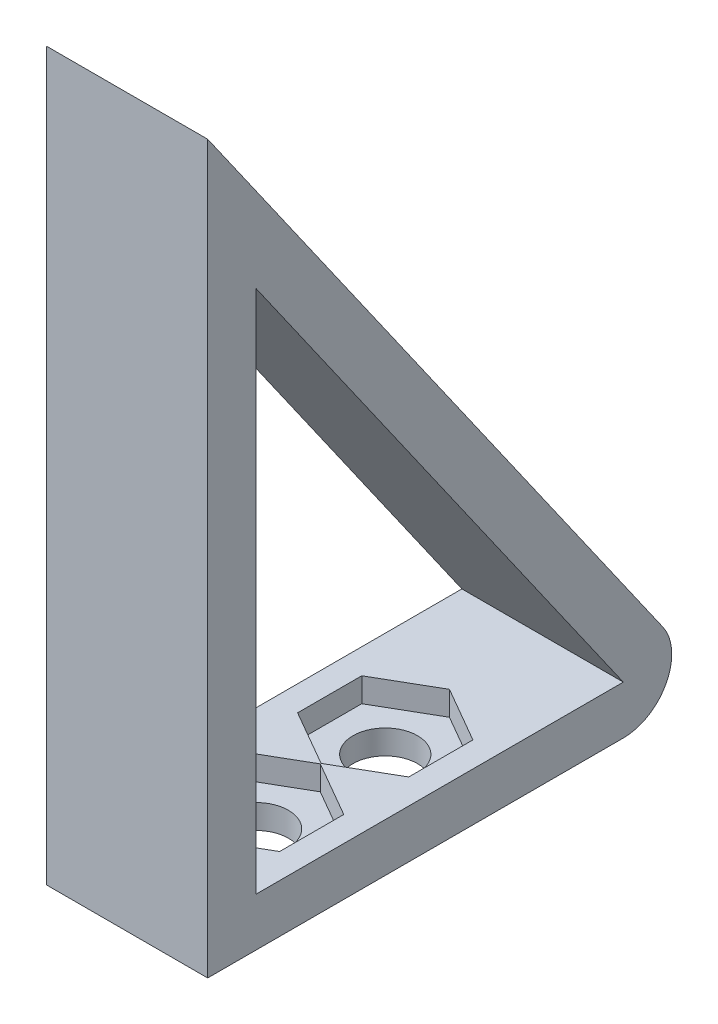
from build123d import *

# Parameters (mm, degrees)
BOSS_EXTRUDE1_DEPTH = 10
CUT_EXTRUDE1_DEPTH  = 56.837607918
SKETCH3_R           = 2
CUT_EXTRUDE2_DEPTH  = 3
CUT_EXTRUDE3_DEPTH  = 1.5
FILLET1_R           = 3


with BuildPart() as part:
    # Sketch1 → Boss-Extrude1 (new body)
    with BuildSketch(Plane(origin=(0, 0, 0), x_dir=(0, 0, -1), z_dir=(1, 0, 0))):
        Polygon((0, 0), (0, 45), (31.509339219, 0), align=None)
    extrude(amount=-BOSS_EXTRUDE1_DEPTH)

    # Sketch2 → Cut-Extrude1 (cut, through all)
    with BuildSketch(Plane(origin=(0, 0, 0), x_dir=(0, 0, -1), z_dir=(1, 0, 0))):
        Polygon((25.746392839, 3), (3, 35.485215593), (3, 3), align=None)
    extrude(amount=-CUT_EXTRUDE1_DEPTH, mode=Mode.SUBTRACT)

    # Sketch3 → Cut-Extrude2 (cut)
    with BuildSketch(Plane.XZ):
        with Locations(Location((-5, -8, 0), (0, 0, 270))):
            Circle(SKETCH3_R)
        with Locations(Location((-5, -16, 0), (0, 0, 270))):
            Circle(SKETCH3_R)
    extrude(amount=-CUT_EXTRUDE2_DEPTH, mode=Mode.SUBTRACT)

    # Sketch4 → Cut-Extrude3 (cut)
    with BuildSketch(Plane(origin=(0, 3, 0), x_dir=(1, 0, 0), z_dir=(0, 1, 0))):
        Polygon((-5, 12.025), (-1.55754902, 14.0125), (-1.55754902, 17.9875), (-5, 19.975), (-8.44245098, 17.9875), (-8.44245098, 14.0125), align=None)
        Polygon((-5, 11.975), (-8.44245098, 9.9875), (-8.44245098, 6.0125), (-5, 4.025), (-1.55754902, 6.0125), (-1.55754902, 9.9875), align=None)
    extrude(amount=-CUT_EXTRUDE3_DEPTH, mode=Mode.SUBTRACT)

    # Fillet1
    fillet1_edges = [part.edges().sort_by_distance(p)[0] for p in [
        (-5, 0, -31.509339219),
    ]]
    fillet(fillet1_edges, radius=FILLET1_R)


solid = part.part
